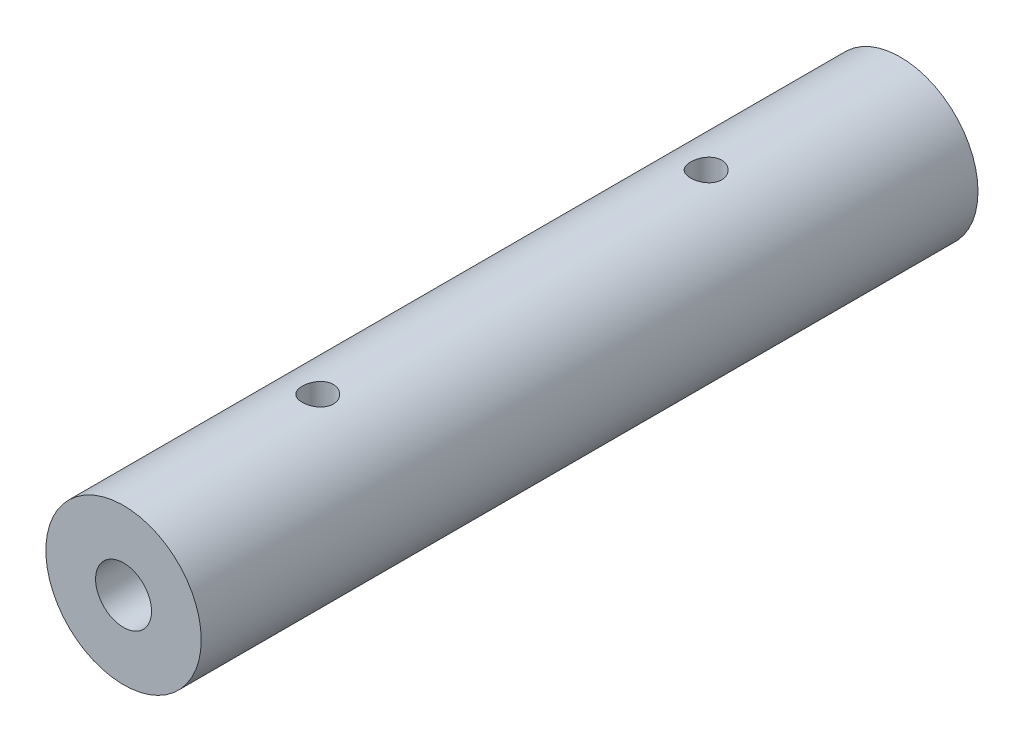
from build123d import *

# Parameters (mm, degrees)
SKETCH1_R           = 6.35
SKETCH1_R_2         = 2.286
BOSS_EXTRUDE1_DEPTH = 31.75
SKETCH3_R           = 1.27
CUT_EXTRUDE1_DEPTH  = 31.75


with BuildPart() as part:
    # Sketch1 → Boss-Extrude1 (new, symmetric)
    with BuildSketch(Plane.XY):
        Circle(SKETCH1_R)
        Circle(SKETCH1_R_2, mode=Mode.SUBTRACT)
    extrude(amount=BOSS_EXTRUDE1_DEPTH, both=True)

    # Sketch3 → Cut-Extrude1 (cut, symmetric)
    with BuildSketch(Plane(origin=(0, 0, 0), x_dir=(1, 0, 0), z_dir=(0, 1, 0))):
        with Locations(Location((0, 15.875, 0), (0, 0, 270))):
            Circle(SKETCH3_R)
        with Locations(Location((0, -15.875, 0), (0, 0, 270))):
            Circle(SKETCH3_R)
    extrude(amount=CUT_EXTRUDE1_DEPTH, both=True, mode=Mode.SUBTRACT)


solid = part.part
